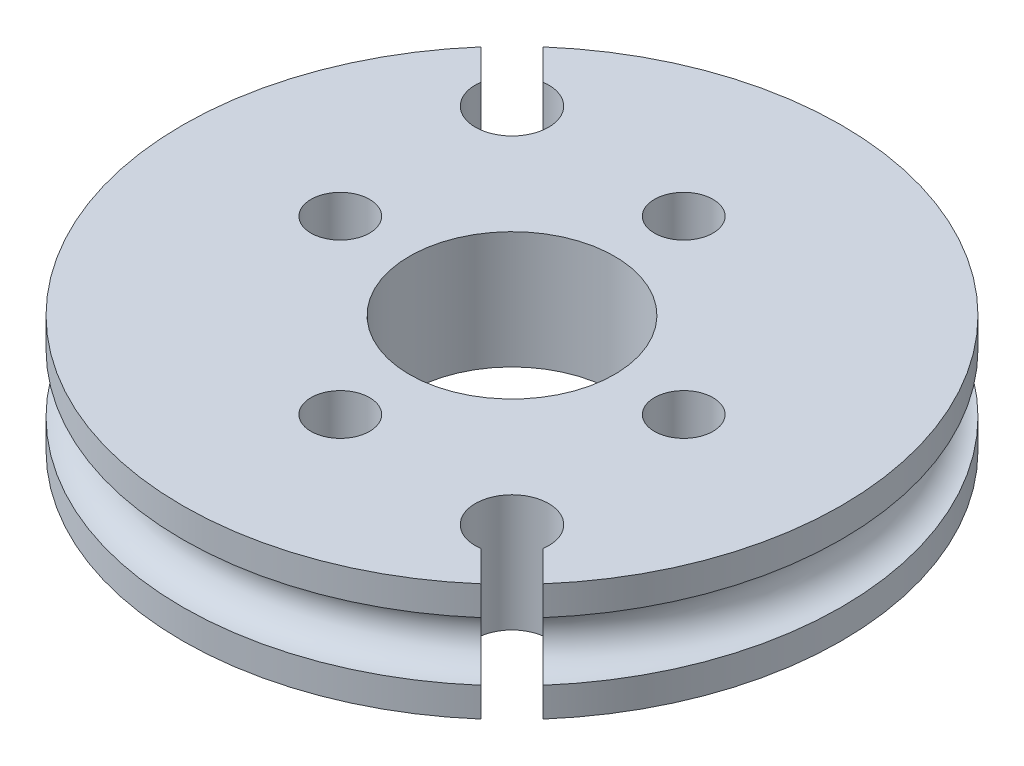
from build123d import *

# Parameters (mm, degrees)
BOSS_EXTRUDE1_DEPTH      = 4
BOSS_EXTRUDE1_DEPTH_BACK = 4
SKETCH1_R                = 22.5
SKETCH1_R_2              = 7
SKETCH1_R_3              = 2
SKETCH1_R_4              = 2.5
SKETCH2_R                = 2
CUT_EXTRUDE1_DEPTH       = 4
CUT_EXTRUDE1_DEPTH_BACK  = 4


with BuildPart() as part:
    # Sketch1 → Boss-Extrude1 (new, two sides: drawn at the far end of the back side and taken through both)
    with BuildSketch(Plane(origin=(0, 0, 0), x_dir=(1, 0, 0), z_dir=(0, 1, 0)).offset(-BOSS_EXTRUDE1_DEPTH_BACK)):
        Circle(SKETCH1_R)
        Circle(SKETCH1_R_2, mode=Mode.SUBTRACT)
        with Locations((0, 11.725)):
            Circle(SKETCH1_R_3, mode=Mode.SUBTRACT)
        with Locations((11.725, 0)):
            Circle(SKETCH1_R_3, mode=Mode.SUBTRACT)
        with Locations((0, -11.725)):
            Circle(SKETCH1_R_3, mode=Mode.SUBTRACT)
        with Locations((-11.725, 0)):
            Circle(SKETCH1_R_3, mode=Mode.SUBTRACT)
        with Locations((-12.374368671, 12.374368671)):
            Circle(SKETCH1_R_4, mode=Mode.SUBTRACT)
        with Locations((12.374368671, -12.374368671)):
            Circle(SKETCH1_R_4, mode=Mode.SUBTRACT)
    extrude(amount=BOSS_EXTRUDE1_DEPTH + BOSS_EXTRUDE1_DEPTH_BACK)

    # Sketch2 → Cut-Revolve7 (revolve, cut)
    with BuildSketch(Plane.XY):
        with Locations((22.5, 0)):
            Circle(SKETCH2_R)
    revolve(axis=Axis((0, 0, 0), (0, 1, 0)), mode=Mode.SUBTRACT)

    # Sketch3 → Cut-Extrude1 (cut, two sides: drawn at the far end of the back side and taken through both)
    with BuildSketch(Plane(origin=(0, 0, 0), x_dir=(1, 0, 0), z_dir=(0, 1, 0)).offset(-CUT_EXTRUDE1_DEPTH_BACK)):
        Polygon((-18.384776311, 16.263455967), (-13.435028843, 11.313708499), (-11.313708499, 13.435028843), (-16.263455967, 18.384776311), align=None)
        Polygon((13.435028843, -11.313708499), (11.313708499, -13.435028843), (16.263455967, -18.384776311), (18.384776311, -16.263455967), align=None)
    extrude(amount=CUT_EXTRUDE1_DEPTH + CUT_EXTRUDE1_DEPTH_BACK, mode=Mode.SUBTRACT)


solid = part.part
